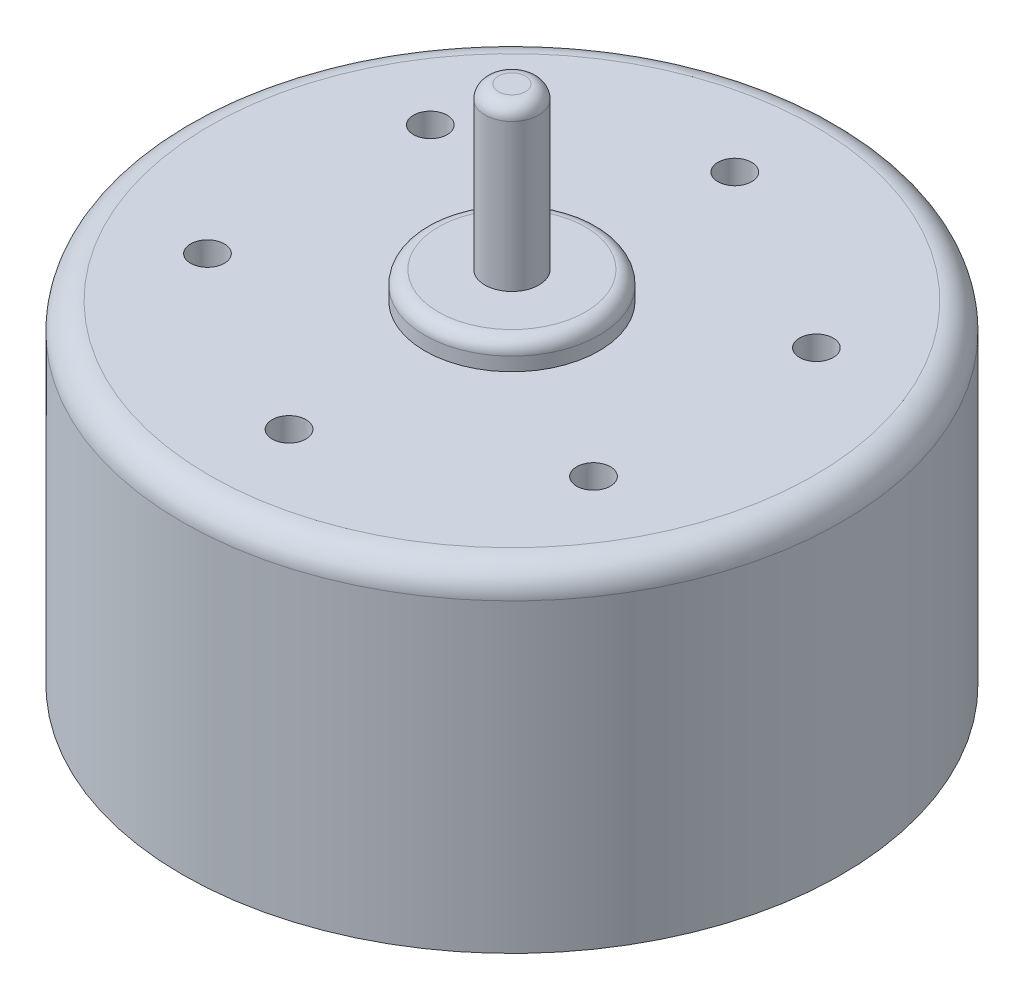
from build123d import *

# Parameters (mm, degrees)
SKETCH1_R                          = 12.2
BOSS_EXTRUDE1_DEPTH                = 12.3
SKETCH2_R                          = 3.225
BOSS_EXTRUDE2_DEPTH                = 1
SKETCH3_R                          = 3.05
BOSS_EXTRUDE3_DEPTH                = 0.5
SKETCH4_R                          = 1
BOSS_EXTRUDE4_DEPTH                = 5.95
FILLET1_R                          = 1
FILLET2_R                          = 0.5
TAP_DRILL_FOR_M1_6X0_35_TAP1_D     = 1.25
TAP_DRILL_FOR_M1_6X0_35_TAP1_DEPTH = 1.1
TAP_DRILL_FOR_M1_6X0_35_TAP1_TIP   = 0.375537887
CUT_EXTRUDE1_START                 = -0.5
SKETCH8_R                          = 11.7
SKETCH8_R_2                        = 3.05
CUT_EXTRUDE1_DEPTH                 = 0.5


with BuildPart() as part:
    # Sketch1 → Boss-Extrude1 (new body)
    with BuildSketch(Plane(origin=(0, 0, 0), x_dir=(1, 0, 0), z_dir=(0, 1, 0))):
        with Locations(Location((0, 0, 0), (0, 0, 270))):
            Circle(SKETCH1_R)
    extrude(amount=BOSS_EXTRUDE1_DEPTH)

    # Sketch2 → Boss-Extrude2 (add)
    with BuildSketch(Plane(origin=(0, 12.3, 0), x_dir=(1, 0, 0), z_dir=(0, 1, 0))):
        with Locations(Location((0, 0, 0), (0, 0, 270))):
            Circle(SKETCH2_R)
    extrude(amount=BOSS_EXTRUDE2_DEPTH)

    # Sketch3 → Boss-Extrude3 (add)
    with BuildSketch(Plane.XZ):
        with Locations(Location((0, 0, 0), (0, 0, 90))):
            Circle(SKETCH3_R)
    extrude(amount=BOSS_EXTRUDE3_DEPTH)

    # Sketch4 → Boss-Extrude4 (add)
    with BuildSketch(Plane(origin=(0, 13.3, 0), x_dir=(1, 0, 0), z_dir=(0, 1, 0))):
        with Locations(Location((0, 0, 0), (0, 0, 270))):
            Circle(SKETCH4_R)
    extrude(amount=BOSS_EXTRUDE4_DEPTH)

    # Fillet1
    fillet1_edges = [part.edges().sort_by_distance(p)[0] for p in [
        (0, 12.3, -12.2),
    ]]
    fillet(fillet1_edges, radius=FILLET1_R)

    # Fillet2
    fillet2_edges = [part.edges().sort_by_distance(p)[0] for p in [
        (0, 19.25, -1),
        (0, 13.3, -3.225),
    ]]
    fillet(fillet2_edges, radius=FILLET2_R)

    # Tap Drill for M1.6x0.35 Tap1
    with Locations(Plane(origin=(0, 12.3, 0), x_dir=(1, 0, 0), z_dir=(0, 1, 0))):
        with Locations((0, -8.25), (-7.144709581, -4.125), (-7.144709581, 4.125), (0, 8.25), (7.144709581, 4.125), (7.144709581, -4.125)):
            Hole(TAP_DRILL_FOR_M1_6X0_35_TAP1_D / 2, depth=TAP_DRILL_FOR_M1_6X0_35_TAP1_DEPTH)
            with Locations((0, 0, -(TAP_DRILL_FOR_M1_6X0_35_TAP1_DEPTH + TAP_DRILL_FOR_M1_6X0_35_TAP1_TIP / 2))):  # 118° drill point
                Cone(0, TAP_DRILL_FOR_M1_6X0_35_TAP1_D / 2, TAP_DRILL_FOR_M1_6X0_35_TAP1_TIP, mode=Mode.SUBTRACT)

    # Sketch8 → Cut-Extrude1 (cut)
    with BuildSketch(Plane.XZ.offset(CUT_EXTRUDE1_START)):
        with Locations(Location((0, 0, 0), (0, 0, 270))):
            Circle(SKETCH8_R)
        with Locations(Location((0, 0, 0), (0, 0, 270))):
            Circle(SKETCH8_R_2, mode=Mode.SUBTRACT)
    extrude(amount=CUT_EXTRUDE1_DEPTH, mode=Mode.SUBTRACT)


solid = part.part
